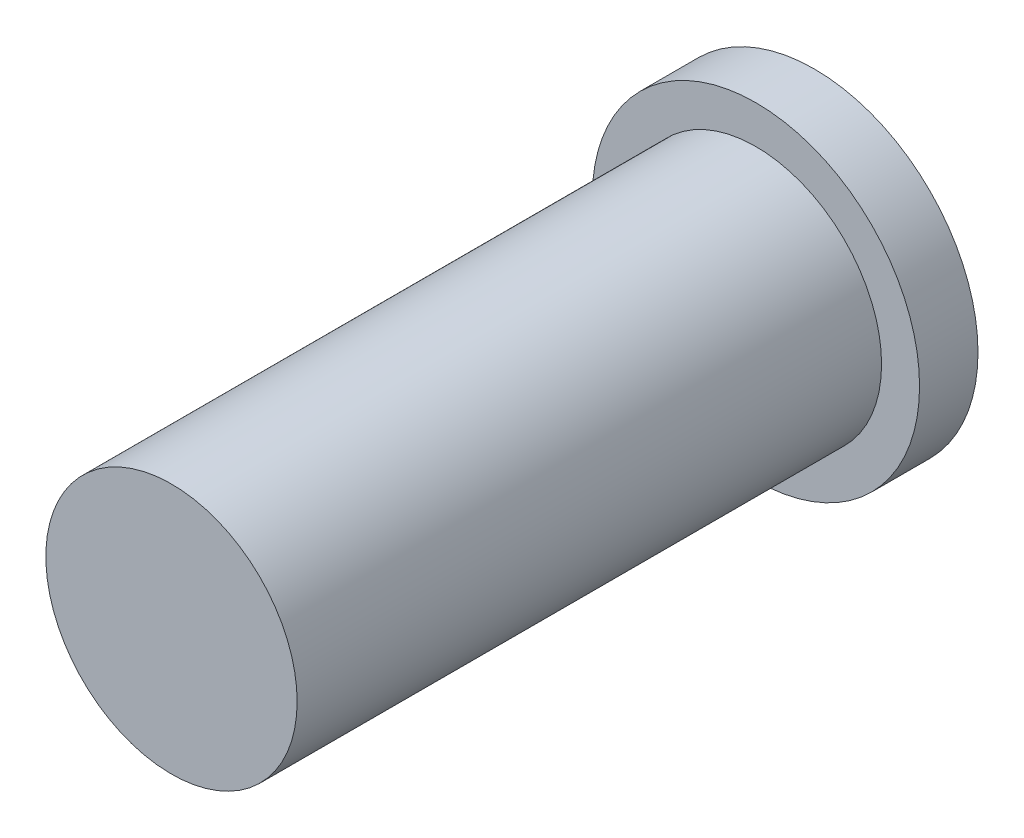
from build123d import *

# Parameters (mm, degrees)
SKIZZE1_R                       = 2.15
AUFSATZ_LINEAR_AUSTRAGEN1_DEPTH = 10
SKIZZE1_3_R                     = 2.8
AUFSATZ_LINEAR_AUSTRAGEN2_DEPTH = 1


with BuildPart() as part:
    # Skizze1 → Aufsatz-Linear austragen1 (new body)
    with BuildSketch(Plane.XY):
        Circle(SKIZZE1_R)
    extrude(amount=AUFSATZ_LINEAR_AUSTRAGEN1_DEPTH)

    # Skizze1<3> → Aufsatz-Linear austragen2 (add)
    with BuildSketch(Plane.XY):
        Circle(SKIZZE1_3_R)
    extrude(amount=-AUFSATZ_LINEAR_AUSTRAGEN2_DEPTH)


solid = part.part
